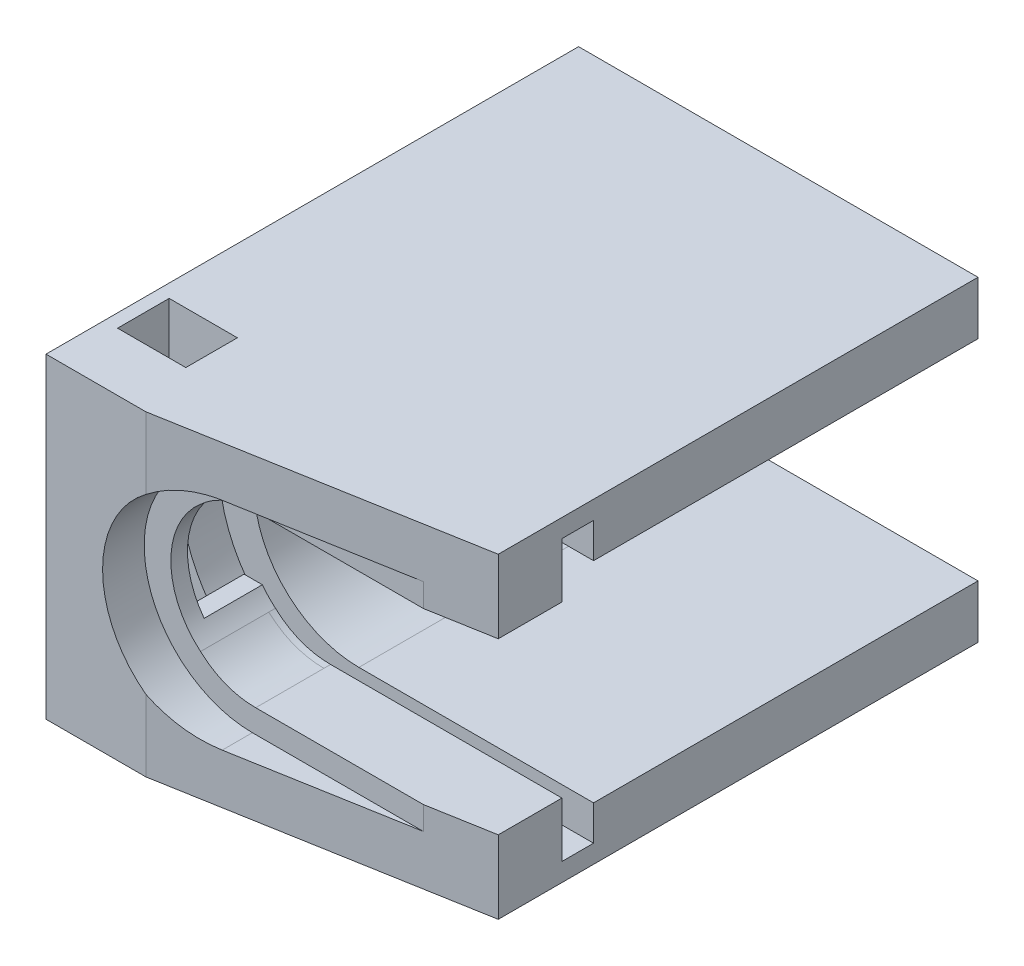
from build123d import *

# Parameters (mm, degrees)
SKETCH_1_24X19_W         = 19
SKETCH_1_24X19_H         = 24
EXTRUDE_1_33_DEPTH       = 33
CUT_EXTRUDE_2_REACH      = 38.377
CUT_EXTRUDE_4_2_DEPTH    = 1.9
CUT_EXTRUDE_6_3_REACH    = 29.71
SKETCH_7_5_W             = 24
SKETCH_7_5_H             = 19
EXTRUDE_7_DEPTH          = 5
CUT_EXTRUDE_10_4_REACH   = 41.925
SKETCH_11_W              = 8.5
SKETCH_11_H              = 3.1
CUT_EXTRUDE_11_5_DEPTH   = 4.9
SKETCH_11D1_W            = 6
SKETCH_11D1_H            = 3.1
CUT_EXTRUDE_11D1_6_DEPTH = 10
CUT_EXTRUDE_12_9_REACH   = 31.655
CUT_EXTRUDE_11_DEPTH     = 3.5
SKETCH_5902_W            = 53.98
SKETCH_5902_H            = 19
CUT_EXTRUDE_12_DEPTH     = 1
CUT_EXTRUDE_13_DEPTH     = 40.102429623
CUT_EXTRUDE_15_REACH     = 33.036
SKETCH_5020_R            = 3.5
EXTRUDE_2_DEPTH          = 0.4
SKETCH_7444_W            = 0.8
SKETCH_7444_H            = 3.1
EXTRUDE_3_DEPTH          = 19
CUT_EXTRUDE_16_DEPTH     = 32.036269144


with BuildPart() as part:
    # 1底部方形_24x19 → 1凸台-拉伸_高33 (new body)
    with BuildSketch(Plane(origin=(0, 0, 0), x_dir=(0, 1, 0), z_dir=(0, 0, 1))):
        Rectangle(SKETCH_1_24X19_W, SKETCH_1_24X19_H)
    extrude(amount=EXTRUDE_1_33_DEPTH)

    # 2吸嘴停靠渐变槽 → 2切除-拉伸 (cut, up to next)
    with BuildSketch(Plane.XY.offset(33), mode=Mode.PRIVATE) as cut_extrude_2_sk1:
        with BuildLine():
            Line((12, -5.1), (12, 5.1))
            Line((12, 5.1), (-1.9, 5.1))
            add(Edge.make_bspline(
                [(-5.213938048, 3.830222216), (-3.829124073, 5.093205317), (-1.9, 5.1)],
                knots=[0, 0, 0, 1, 1, 1], degree=2))
            ThreePointArc((-5.213938048, 3.830222216), (-7, 0), (-5.213938048, -3.830222216))
            add(Edge.make_bspline(
                [(-5.213938048, -3.830222216), (-3.829124073, -5.093205317), (-1.9, -5.1)],
                knots=[0, 0, 0, 1, 1, 1], degree=2))
            Line((-1.9, -5.1), (12, -5.1))
        make_face()
    cut_extrude_2_tool1 = extrude(cut_extrude_2_sk1.sketch, amount=-CUT_EXTRUDE_2_REACH, mode=Mode.PRIVATE) & part.part
    add(cut_extrude_2_tool1.solids().sort_by_distance((3.017719, 0, 33))[0], mode=Mode.SUBTRACT)

    # 4反光板停靠槽 → 4切除-拉伸2 (cut)
    with BuildSketch(Plane.XY.offset(25)):
        with BuildLine():
            Line((-0.7, 8.4), (12, 8.4))
            Line((12, 8.4), (12, -8.4))
            Line((12, -8.4), (-0.7, -8.4))
            ThreePointArc((-0.7, -8.4), (-10.5, 0), (-0.7, 8.4))
        make_face()
    extrude(amount=-CUT_EXTRUDE_4_2_DEPTH, mode=Mode.SUBTRACT)

    # 6反光板小圆柱 → 6切除-拉伸3 (cut, up to next)
    with BuildSketch(Plane.XY.offset(23.1), mode=Mode.PRIVATE) as cut_extrude_6_3_sk1:
        with BuildLine():
            Line((-2.1, -6.3), (12, -6.3))
            Line((12, -6.3), (12, 6.3))
            Line((12, 6.3), (-2.1, 6.3))
            ThreePointArc((-2.1, 6.3), (-8.4, 0), (-2.1, -6.3))
        make_face()
    cut_extrude_6_3_tool1 = extrude(cut_extrude_6_3_sk1.sketch, amount=-CUT_EXTRUDE_6_3_REACH, mode=Mode.PRIVATE) & part.part
    add(cut_extrude_6_3_tool1.solids().sort_by_distance((2.424095, 0, 23.1))[0], mode=Mode.SUBTRACT)

    # 7草图5 → 7凸台-拉伸_底板厚度 (add)
    with BuildSketch(Plane(origin=(0, 0, 0), x_dir=(1, 0, 0), z_dir=(0, 0, -1))):
        Rectangle(SKETCH_7_5_W, SKETCH_7_5_H)
    extrude(amount=-EXTRUDE_7_DEPTH)

    # 10切除-拉伸4: up to this face of the body (flat: up to its plane)
    cut_extrude_10_4_end = Plane(part.part.faces().sort_by_distance((0, -9.5, 16.5))[0])
    # Sketch 10 → 10切除-拉伸4 (cut, up to the picked face)
    with BuildSketch(Plane(origin=(0, 9.5, 0), x_dir=(-1, 0, 0), z_dir=(0, 1, 0)), mode=Mode.PRIVATE) as cut_extrude_10_4_sk1:
        Polygon((-12, 31.162738066), (-12, 33), (9, 33), align=None)
    cut_extrude_10_4_tool1 = split(extrude(cut_extrude_10_4_sk1.sketch, amount=-CUT_EXTRUDE_10_4_REACH, mode=Mode.PRIVATE), bisect_by=cut_extrude_10_4_end, keep=Keep.BOTH, mode=Mode.PRIVATE)
    add(cut_extrude_10_4_tool1.solids().sort_by(Axis((5, 9.5, 32.387579), (0, -1, 0)))[0], mode=Mode.SUBTRACT)

    # Sketch 11 → 11切除-拉伸5 (cut)
    with BuildSketch(Plane(origin=(-12, 0, 0), x_dir=(0, -1, 0), z_dir=(-1, 0, 0))):
        with Locations((-5.25, 26.95)):
            Rectangle(SKETCH_11_W, SKETCH_11_H)
        with Locations((5.25, 26.95)):
            Rectangle(SKETCH_11_W, SKETCH_11_H)
    extrude(amount=-CUT_EXTRUDE_11_5_DEPTH, mode=Mode.SUBTRACT)

    # 11d1_磁铁开窗 → 11d1切除-拉伸6 (cut)
    with BuildSketch(Plane(origin=(-12, 0, 0), x_dir=(0, -1, 0), z_dir=(-1, 0, 0))):
        with Locations((0, 26.95)):
            Rectangle(SKETCH_11D1_W, SKETCH_11D1_H)
    extrude(amount=-CUT_EXTRUDE_11D1_6_DEPTH, mode=Mode.SUBTRACT)

    # 12切除薄壁 → 12切除-拉伸9 (cut, up to next)
    with BuildSketch(Plane.XY.offset(25.4), mode=Mode.PRIVATE) as cut_extrude_12_9_sk1:
        with BuildLine():
            Line((-0.7, 8.4), (-0.7, -8.4))
            ThreePointArc((-0.7, -8.4), (-10.5, 0), (-0.7, 8.4))
        make_face()
    cut_extrude_12_9_tool1 = extrude(cut_extrude_12_9_sk1.sketch, amount=-CUT_EXTRUDE_12_9_REACH, mode=Mode.PRIVATE) & part.part
    add(cut_extrude_12_9_tool1.solids().sort_by_distance((-4.916056, 0, 25.4))[0], mode=Mode.SUBTRACT)

    # Sketch 5392 → 切除-拉伸11 (cut)
    with BuildSketch(Plane.XY.offset(33)):
        with BuildLine():
            Line((-2.099999748, 6.5), (12, 6.5))
            Line((12, 6.5), (12, -6.5))
            Line((12, -6.5), (-2.099999748, -6.5))
            ThreePointArc((-2.099999748, -6.5), (-8.6, 0), (-2.099999748, 6.5))
        make_face()
    extrude(amount=-CUT_EXTRUDE_11_DEPTH, mode=Mode.SUBTRACT)

    # Sketch 5902 → 切除-拉伸12 (cut)
    with BuildSketch(Plane.XY.offset(33)):
        with Locations((14.99, 0)):
            Rectangle(SKETCH_5902_W, SKETCH_5902_H)
    extrude(amount=-CUT_EXTRUDE_12_DEPTH, mode=Mode.SUBTRACT)

    # Sketch 6207 → 切除-拉伸13 (cut, through all)
    with BuildSketch(Plane.XZ.offset(9.5)):
        Polygon((2.430052303, 32), (12, 31.162738066), (12, 28.826114347), (-6, 32), align=None)
    extrude(amount=-CUT_EXTRUDE_13_DEPTH, mode=Mode.SUBTRACT)

    # Sketch 5020 → 切除-拉伸15 (cut, up to next)
    with BuildSketch(Plane.XY.offset(5), mode=Mode.PRIVATE) as cut_extrude_15_sk1:
        with Locations((2, 0)):
            Circle(SKETCH_5020_R)
    cut_extrude_15_tool1 = extrude(cut_extrude_15_sk1.sketch, amount=-CUT_EXTRUDE_15_REACH, mode=Mode.PRIVATE) & part.part
    add(cut_extrude_15_tool1.solids().sort_by_distance((2, 0, 5))[0], mode=Mode.SUBTRACT)

    # Sketch 6982 → 凸台-拉伸2 (add)
    with BuildSketch(Plane(origin=(0, 0, 25.4), x_dir=(1, 0, 0), z_dir=(0, 0, -1))):
        with BuildLine():
            Line((-7.1, -3), (-7.1, -6.8))
            ThreePointArc((-7.1, -6.8), (-4.061552813, -8.246211251), (-0.7, -8.4))
            Line((-0.7, -8.4), (-0.7, -5.1))
            Line((-0.7, -5.1), (-1.9, -5.1))
            add(Edge.make_bspline(
                [(-1.9, -5.1), (-3.829124073, -5.093205317), (-5.213938048, -3.830222216)],
                knots=[0, 0, 0, 1, 1, 1], degree=2))
            ThreePointArc((-5.213938048, -3.830222216), (-5.630777158, -3.437652866), (-6, -3))
            Line((-6, -3), (-7.1, -3))
        make_face()
        with BuildLine():
            Line((-7.1, 3), (-6, 3))
            ThreePointArc((-6, 3), (-5.630777158, 3.437652866), (-5.213938048, 3.830222216))
            add(Edge.make_bspline(
                [(-5.213938048, 3.830222216), (-3.829124073, 5.093205317), (-1.9, 5.1)],
                knots=[0, 0, 0, 1, 1, 1], degree=2))
            Line((-1.9, 5.1), (-0.7, 5.1))
            Line((-0.7, 5.1), (-0.7, 8.4))
            ThreePointArc((-0.7, 8.4), (-4.061552813, 8.246211251), (-7.1, 6.8))
            Line((-7.1, 6.8), (-7.1, 3))
        make_face()
    extrude(amount=EXTRUDE_2_DEPTH)

    # Sketch 7444 → 凸台-拉伸3 (add)
    with BuildSketch(Plane.XZ.offset(9.5)):
        with Locations((-11.6, 26.95)):
            Rectangle(SKETCH_7444_W, SKETCH_7444_H)
    extrude(amount=-EXTRUDE_3_DEPTH)

    # 草图13 → 切除-拉伸16 (cut, through all)
    with BuildSketch(Plane.XY.offset(5)):
        with BuildLine():
            Line((-2.1, -6.3), (12, -6.3))
            Line((12, -6.3), (12, 6.3))
            Line((12, 6.3), (-2.1, 6.3))
            ThreePointArc((-2.1, 6.3), (-8.4, 0), (-2.1, -6.3))
        make_face()
    extrude(amount=-CUT_EXTRUDE_16_DEPTH, mode=Mode.SUBTRACT)


solid = part.part
